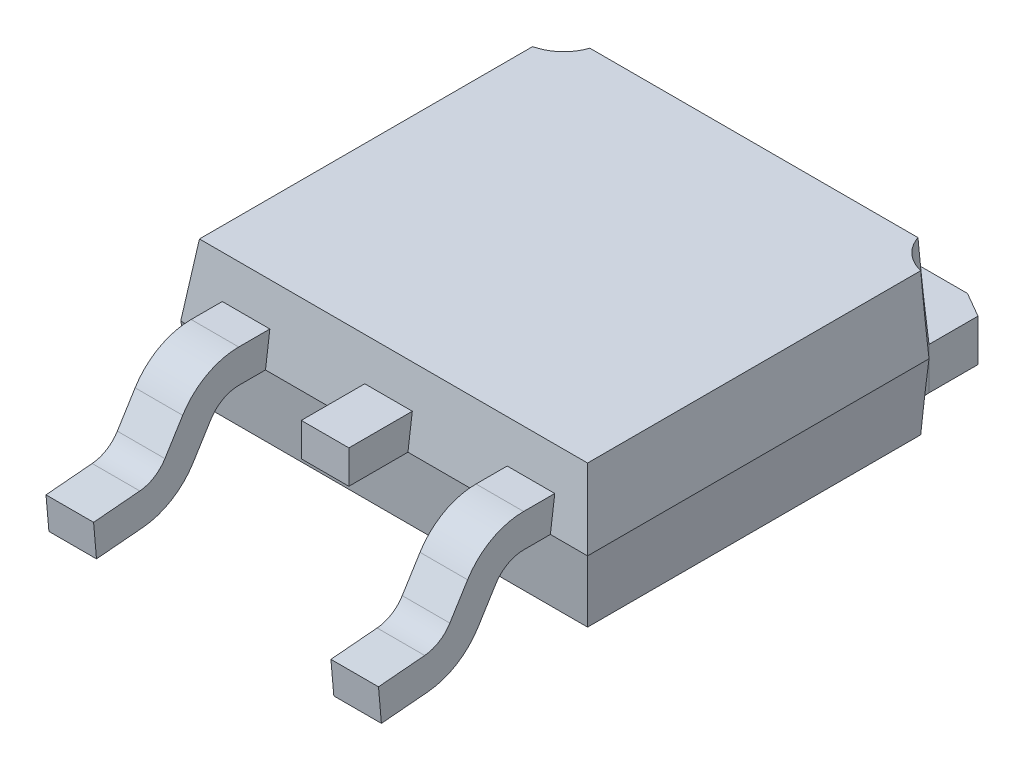
from build123d import *

# Parameters (mm, degrees)
SKETCH1_W                  = 6.54
SKETCH1_H                  = 6.095
EXTRUDE1_DEPTH             = 1.1425
EXTRUDE1_TAPER             = 7.5
EXTRUDE1_OTHER_WAY_DEPTH   = 1.1425
EXTRUDE1_OTHER_WAY_TAPER   = 7.5
EXTRUDE2_REACH             = 6.614
EXTRUDE2_DIRECTION_2_REACH = 6.614
CUT_EXTRUDE5_REACH         = 7.74
EXTRUDE5_DEPTH             = 0.3825
SKETCH29_W                 = 1.02
SKETCH29_H                 = 0.535
EXTRUDE6_DEPTH             = 0.3825


with BuildPart() as part:
    # Sketch1 → Extrude1 (new body)
    with BuildSketch(Plane(origin=(0, 0, 0), x_dir=(1, 0, 0), z_dir=(0, 1, 0))):
        Rectangle(SKETCH1_W, SKETCH1_H)
    extrude(amount=EXTRUDE1_DEPTH, taper=EXTRUDE1_TAPER)

    # Sketch1 → Extrude1 other way (add)
    with BuildSketch(Plane(origin=(0, 0, 0), x_dir=(1, 0, 0), z_dir=(0, 1, 0))):
        Rectangle(SKETCH1_W, SKETCH1_H)
    extrude(amount=-EXTRUDE1_OTHER_WAY_DEPTH, taper=EXTRUDE1_OTHER_WAY_TAPER)

    # Extrude2: up to this plane
    extrude2_end = Plane(origin=(3.27, 0, -3.0475), z_dir=(0.9914448613738104, -0.13052619222005188, 0))
    # Sketch2 → Extrude2 (add, up to the surface)
    with BuildSketch(Plane(origin=(0, 0, 0), x_dir=(0, 0, -1), z_dir=(1, 0, 0)), mode=Mode.PRIVATE) as extrude2_sk1:
        Polygon((3.0475, 0), (2.897087022, -1.1425), (4.1275, -1.1425), (4.1275, -0.4675), (3.109047543, -0.4675), align=None)
    extrude2_tool1 = split(extrude(extrude2_sk1.sketch, amount=EXTRUDE2_REACH, mode=Mode.PRIVATE), bisect_by=extrude2_end, keep=Keep.BOTH, mode=Mode.PRIVATE)
    add(extrude2_tool1.solids().sort_by_distance((0, -0.791952, -3.517345))[0])

    # Extrude2 direction 2: up to this plane
    extrude2_direction_2_end = Plane(origin=(-3.27, 0, -3.0475), z_dir=(-0.9914448613738104, -0.13052619222005188, 0))
    # Sketch2 → Extrude2 direction 2 (add, up to the surface)
    with BuildSketch(Plane(origin=(0, 0, 0), x_dir=(0, 0, -1), z_dir=(1, 0, 0)), mode=Mode.PRIVATE) as extrude2_direction_2_sk1:
        Polygon((3.0475, 0), (2.897087022, -1.1425), (4.1275, -1.1425), (4.1275, -0.4675), (3.109047543, -0.4675), align=None)
    extrude2_direction_2_tool1 = split(extrude(extrude2_direction_2_sk1.sketch, amount=-EXTRUDE2_DIRECTION_2_REACH, mode=Mode.PRIVATE), bisect_by=extrude2_direction_2_end, keep=Keep.BOTH, mode=Mode.PRIVATE)
    add(extrude2_direction_2_tool1.solids().sort_by_distance((0, -0.791952, -3.517345))[0])

    # Sketch27 → Cut-Extrude5 (cut, up to next)
    with BuildSketch(Plane(origin=(0, 1.1425, 0), x_dir=(1, 0, 0), z_dir=(0, 1, 0)), mode=Mode.PRIVATE) as cut_extrude5_sk1:
        with BuildLine():
            Line((2.6025, 3.109047543), (2.6025, 3.896559892))
            Line((2.6025, 3.896559892), (2.2025, 4.1275))
            Line((2.2025, 4.1275), (3.27, 4.1275))
            Line((3.27, 4.1275), (3.27, 2.441547543))
            ThreePointArc((3.27, 2.441547543), (2.798006224, 2.637053766), (2.6025, 3.109047543))
        make_face()
    cut_extrude5_tool1 = extrude(cut_extrude5_sk1.sketch, amount=-CUT_EXTRUDE5_REACH, mode=Mode.PRIVATE) & part.part
    # Sketch27 → Cut-Extrude5 (cut, up to next)
    with BuildSketch(Plane(origin=(0, 1.1425, 0), x_dir=(1, 0, 0), z_dir=(0, 1, 0)), mode=Mode.PRIVATE) as cut_extrude5_sk2:
        with BuildLine():
            Line((-2.6025, 3.896559892), (-2.2025, 4.1275))
            Line((-2.2025, 4.1275), (-3.27, 4.1275))
            Line((-3.27, 4.1275), (-3.27, 2.441547543))
            ThreePointArc((-3.27, 2.441547543), (-2.798006224, 2.637053766), (-2.6025, 3.109047543))
            Line((-2.6025, 3.109047543), (-2.6025, 3.896559892))
        make_face()
    cut_extrude5_tool2 = extrude(cut_extrude5_sk2.sketch, amount=-CUT_EXTRUDE5_REACH, mode=Mode.PRIVATE) & part.part
    add(cut_extrude5_tool1.solids().sort_by_distance((2.932609, 1.1425, -3.37907))[0], mode=Mode.SUBTRACT)
    add(cut_extrude5_tool2.solids().sort_by_distance((-2.932609, 1.1425, -3.37907))[0], mode=Mode.SUBTRACT)

    # Sketch28 → Extrude5 (add, symmetric)
    with BuildSketch(Plane(origin=(2.29, 0, 0), x_dir=(0, 0, -1), z_dir=(1, 0, 0))):
        with BuildLine():
            Line((-2.977065914, 0.535), (-3.477818827, 0.535))
            ThreePointArc((-3.477818827, 0.535), (-3.993129319, 0.401312635), (-4.378457731, 0.033971882))
            Line((-4.378457731, 0.033971882), (-4.663971185, -0.426059351))
            ThreePointArc((-4.663971185, -0.426059351), (-4.836678027, -0.598050142), (-5.068098093, -0.6745566))
            Line((-5.068098093, -0.6745566), (-5.810814161, -0.739535837))
            Line((-5.810814161, -0.739535837), (-5.764185839, -1.2725))
            Line((-5.764185839, -1.2725), (-5.018976864, -1.207302663))
            ThreePointArc((-5.018976864, -1.207302663), (-4.556136732, -1.054289745), (-4.210723048, -0.710308165))
            Line((-4.210723048, -0.710308165), (-3.925356764, -0.250514059))
            ThreePointArc((-3.925356764, -0.250514059), (-3.732692558, -0.066843683), (-3.475037312, 0))
            Line((-3.475037312, 0), (-2.977065914, 0))
            Line((-2.977065914, 0), (-2.977065914, 0.535))
        make_face()
    extrude5 = extrude(amount=EXTRUDE5_DEPTH, both=True)

    # Sketch29 → Extrude6 (add, symmetric)
    with BuildSketch(Plane(origin=(0, 0, 0), x_dir=(0, 0, -1), z_dir=(1, 0, 0))):
        with Locations((-3.487065914, 0.2675)):
            Rectangle(SKETCH29_W, SKETCH29_H)
    extrude(amount=EXTRUDE6_DEPTH, both=True)

    # Mirror1: Extrude5 across plane
    add(extrude5.mirror(Plane(origin=(0, 0, 0), x_dir=(0, 0, 1), z_dir=(1, 0, 0))))


solid = part.part
